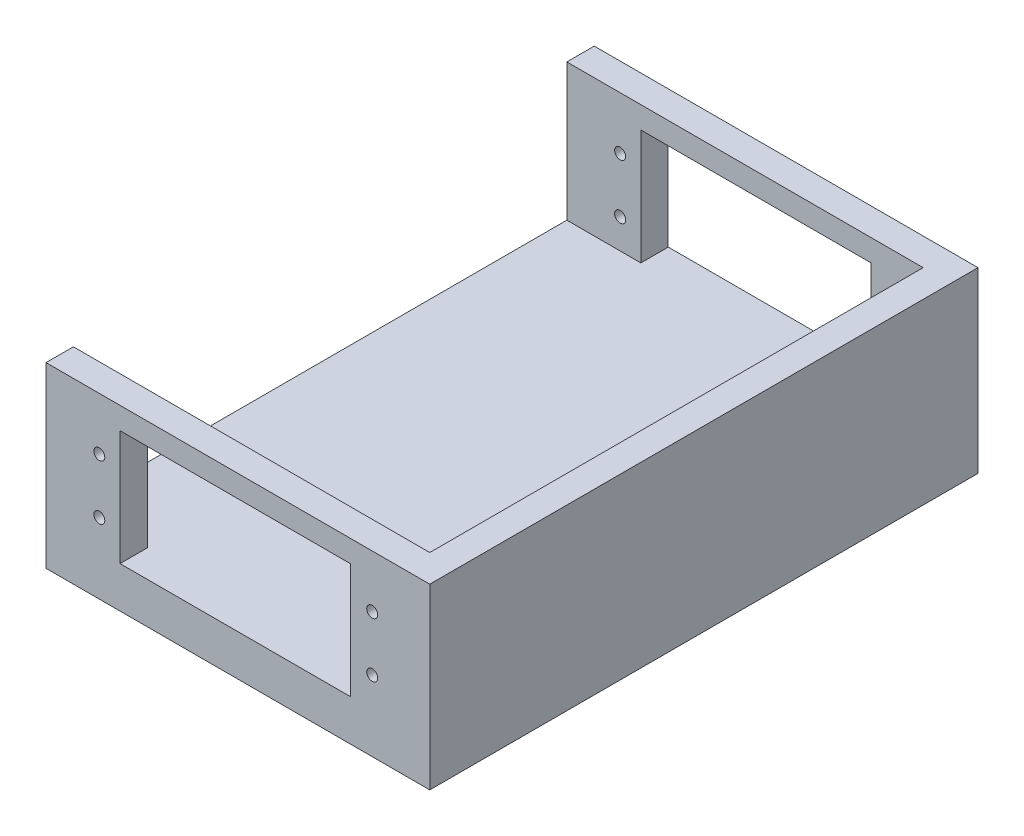
from build123d import *

# Parameters (mm, degrees)
SKETCH1_W            = 70
SKETCH1_H            = 50
BOSS_EXTRUDE1_DEPTH  = 7.5
SKETCH2_W            = 70
SKETCH2_H            = 5
BOSS_EXTRUDE2_DEPTH  = 25
SKETCH3_R            = 1
SKETCH3_W            = 42
SKETCH3_H            = 21
CUT_EXTRUDE1_DEPTH   = 30
SKETCH27_W           = 5
SKETCH27_H           = 25
BOSS_EXTRUDE18_DEPTH = 45


with BuildPart() as part:
    # Sketch1 → Boss-Extrude1 (new body)
    with BuildSketch(Plane(origin=(0, 0, 0), x_dir=(1, 0, 0), z_dir=(0, 1, 0))):
        with Locations((35, 25)):
            Rectangle(SKETCH1_W, SKETCH1_H)
    boss_extrude1 = extrude(amount=BOSS_EXTRUDE1_DEPTH)

    # Sketch2 → Boss-Extrude2 (add)
    with BuildSketch(Plane(origin=(0, 7.5, 0), x_dir=(1, 0, 0), z_dir=(0, 1, 0))):
        with Locations((35, 2.5)):
            Rectangle(SKETCH2_W, SKETCH2_H)
    boss_extrude2 = extrude(amount=BOSS_EXTRUDE2_DEPTH)

    # Sketch3 → Cut-Extrude1 (cut)
    with BuildSketch(Plane.XY):
        with Locations((9.720773398, 22.9)):
            Circle(SKETCH3_R)
        with Locations((9.720773398, 12.9)):
            Circle(SKETCH3_R)
        with Locations((59.5, 12.9)):
            Circle(SKETCH3_R)
        with Locations((59.5, 22.9)):
            Circle(SKETCH3_R)
        with Locations((34.5, 18)):
            Rectangle(SKETCH3_W, SKETCH3_H)
    cut_extrude1 = extrude(amount=-CUT_EXTRUDE1_DEPTH, mode=Mode.SUBTRACT)

    # Sketch27 → Boss-Extrude18 (add)
    with BuildSketch(Plane(origin=(0, 0, -5), x_dir=(-1, 0, 0), z_dir=(0, 0, -1))):
        with Locations((-67.5, 20)):
            Rectangle(SKETCH27_W, SKETCH27_H)
    boss_extrude18 = extrude(amount=BOSS_EXTRUDE18_DEPTH)

    # Mirror1: Boss-Extrude1, Boss-Extrude2, Cut-Extrude1, Boss-Extrude18 across plane
    add(boss_extrude1.mirror(Plane(origin=(0, 0, -50), x_dir=(1, 0, 0), z_dir=(0, 0, -1))))
    add(boss_extrude2.mirror(Plane(origin=(0, 0, -50), x_dir=(1, 0, 0), z_dir=(0, 0, -1))))
    add(cut_extrude1.mirror(Plane(origin=(0, 0, -50), x_dir=(1, 0, 0), z_dir=(0, 0, -1))), mode=Mode.SUBTRACT)
    add(boss_extrude18.mirror(Plane(origin=(0, 0, -50), x_dir=(1, 0, 0), z_dir=(0, 0, -1))))


solid = part.part
